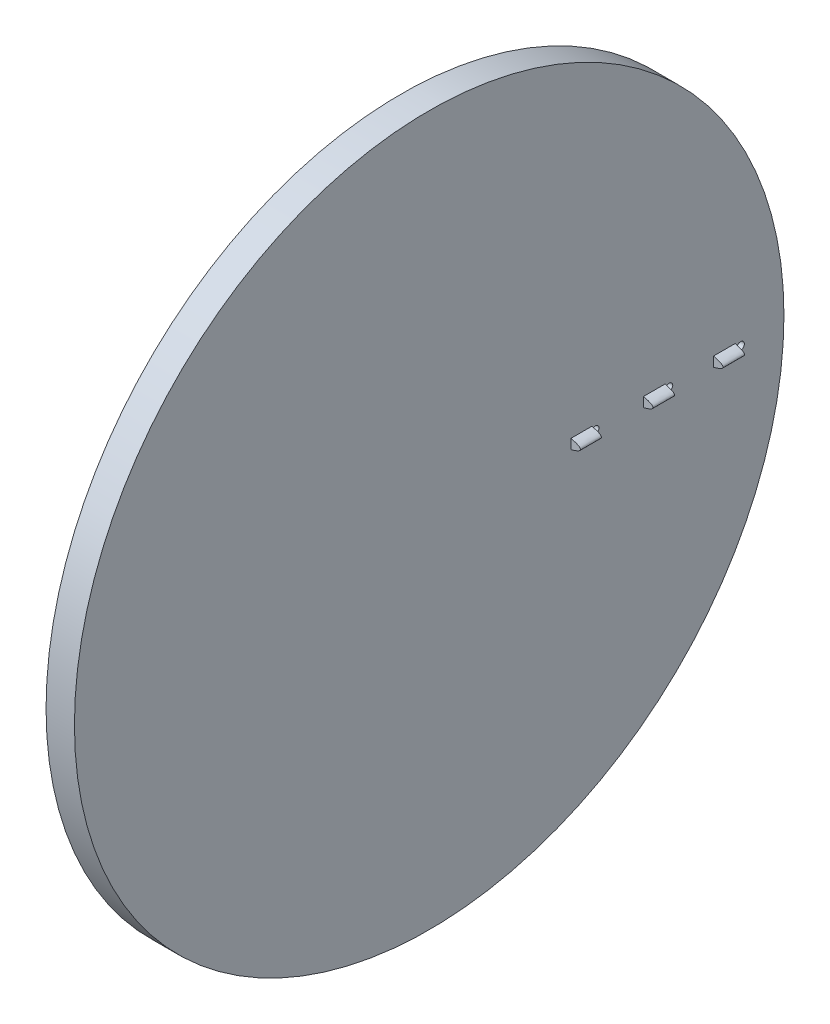
from build123d import *

# Parameters (mm, degrees)
CROQUIS1_R              = 37.5
SALIENTE_EXTRUIR1_DEPTH = 3
CROQUIS3_W              = 2.216229218
CROQUIS3_H              = 1.031247755
CROQUIS3_W_2            = 2.277685896
SALIENTE_EXTRUIR2_DEPTH = 1
CORTAR_EXTRUIR1_DEPTH   = 20
CROQUIS5_R              = 0.35967939
CROQUIS5_R_2            = 0.365171254
CROQUIS5_R_3            = 0.400306504
CORTAR_EXTRUIR2_DEPTH   = 20


with BuildPart() as part:
    # Croquis1 → Saliente-Extruir1 (new body)
    with BuildSketch(Plane(origin=(0, 0, 0), x_dir=(0, 0, -1), z_dir=(1, 0, 0))):
        Circle(CROQUIS1_R)
    extrude(amount=SALIENTE_EXTRUIR1_DEPTH)

    # Croquis3 → Saliente-Extruir2 (add)
    with BuildSketch(Plane(origin=(3, 0, 0), x_dir=(0, 0, -1), z_dir=(1, 0, 0))):
        with Locations((16.1, -0.515623878)):
            Rectangle(CROQUIS3_W, CROQUIS3_H)
        with Locations((23.8, -0.515623878)):
            Rectangle(CROQUIS3_W_2, CROQUIS3_H)
        with Locations((31.2, -0.515623878)):
            Rectangle(CROQUIS3_W_2, CROQUIS3_H)
    extrude(amount=SALIENTE_EXTRUIR2_DEPTH)

    # Croquis4 → Cortar-Extruir1 (cut)
    with BuildSketch(Plane(origin=(0, 0, -32.338842948), x_dir=(-1, 0, 0), z_dir=(0, 0, -1))):
        with BuildLine():
            add(Edge.make_bspline(
                [(-3, 0), (-4, -0.257811939), (-4, -0.515623877)],
                knots=[0, 0, 0, 0.5, 0.5, 0.5], degree=2))
            Line((-3, 0), (-4, 0))
            Line((-4, 0), (-4, -0.515623877))
        make_face()
        with BuildLine():
            Line((-4, -1.031247755), (-3, -1.031247755))
            add(Edge.make_bspline(
                [(-4, -0.515623877), (-4, -0.773435816), (-3, -1.031247755)],
                knots=[0.5, 0.5, 0.5, 1, 1, 1], degree=2))
            Line((-4, -0.515623877), (-4, -1.031247755))
        make_face()
    extrude(amount=-CORTAR_EXTRUIR1_DEPTH, mode=Mode.SUBTRACT)

    # Croquis5 → Cortar-Extruir2 (cut)
    with BuildSketch(Plane(origin=(3, 0, 0), x_dir=(0, 0, -1), z_dir=(1, 0, 0))):
        with Locations((17.58621928, -0.515623877)):
            Circle(CROQUIS5_R)
        with Locations((25.380798287, -0.515623877)):
            Circle(CROQUIS5_R_2)
        with Locations((32.915617677, -0.515623877)):
            Circle(CROQUIS5_R_3)
    extrude(amount=-CORTAR_EXTRUIR2_DEPTH, mode=Mode.SUBTRACT)


solid = part.part
